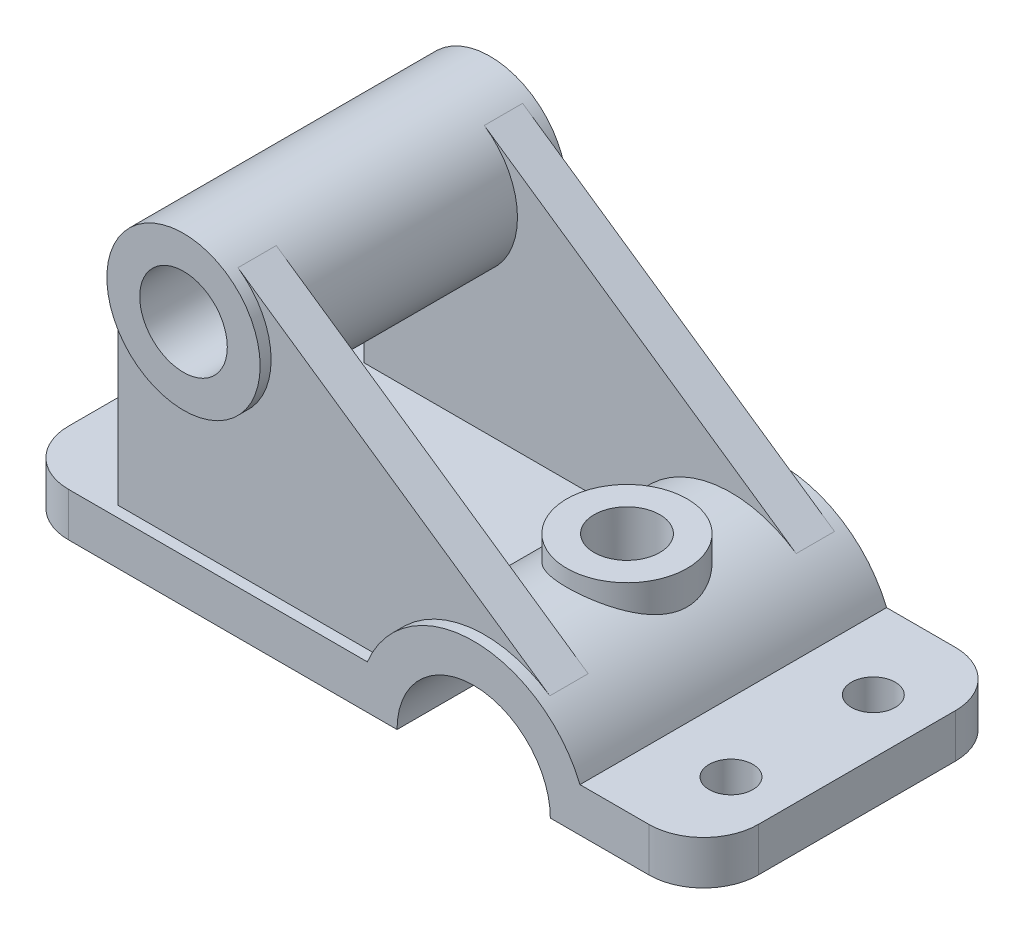
from build123d import *

# Parameters (mm, degrees)
BOSS_EXTRUDE1_DEPTH = 56
FILLET1_R           = 10
SKETCH2_R           = 4
CUT_EXTRUDE1_DEPTH  = 56
SKETCH4_R           = 11
SKETCH4_R_2         = 6
BOSS_EXTRUDE2_DEPTH = 10
CUT_EXTRUDE2_START  = -34
SKETCH5_R           = 6
CUT_EXTRUDE2_DEPTH  = 34
SKETCH6_R           = 14
SKETCH6_R_2         = 8
BOSS_EXTRUDE3_DEPTH = 56
BOSS_EXTRUDE4_START = -7
BOSS_EXTRUDE4_DEPTH = 7
BOSS_EXTRUDE5_DEPTH = 7


with BuildPart() as part:
    # Sketch1 → Boss-Extrude1 (new body)
    with BuildSketch(Plane.XY):
        with BuildLine():
            Line((0, 0), (70, 0))
            ThreePointArc((70, 0), (84, 14), (98, 0))
            Line((98, 0), (126, 0))
            Line((126, 0), (126, 8))
            Line((126, 8), (103.416487839, 8))
            ThreePointArc((103.416487839, 8), (84, 21), (64.583512161, 8))
            Line((64.583512161, 8), (0, 8))
            Line((0, 8), (0, 0))
        make_face()
    extrude(amount=BOSS_EXTRUDE1_DEPTH)

    # Fillet1
    fillet1_edges = [part.edges().sort_by_distance(p)[0] for p in [
        (0, 4, 0),
        (126, 4, 56),
        (0, 4, 56),
        (126, 4, 0),
    ]]
    fillet(fillet1_edges, radius=FILLET1_R)

    # Sketch2 → Cut-Extrude1 (cut)
    with BuildSketch(Plane(origin=(0, 8, 0), x_dir=(1, 0, 0), z_dir=(0, 1, 0))):
        with Locations(Location((10, -15, 0), (0, 0, 270))):
            Circle(SKETCH2_R)
        with Locations(Location((10, -41, 0), (0, 0, 270))):
            Circle(SKETCH2_R)
        with Locations(Location((116, -15, 0), (0, 0, 270))):
            Circle(SKETCH2_R)
        with Locations(Location((116, -41, 0), (0, 0, 270))):
            Circle(SKETCH2_R)
    extrude(amount=-CUT_EXTRUDE1_DEPTH, mode=Mode.SUBTRACT)

    # Sketch4 → Boss-Extrude2 (add)
    with BuildSketch(Plane(origin=(0, 14, 0), x_dir=(-1, 0, 0), z_dir=(0, -1, 0))):
        with Locations(Location((-84, -28, 0), (0, 0, 90))):
            Circle(SKETCH4_R)
        with Locations(Location((-84, -28, 0), (0, 0, 90))):
            Circle(SKETCH4_R_2, mode=Mode.SUBTRACT)
    extrude(amount=-BOSS_EXTRUDE2_DEPTH)

    # Sketch5 → Cut-Extrude2 (cut)
    with BuildSketch(Plane(origin=(0, 24, 0), x_dir=(1, 0, 0), z_dir=(0, 1, 0)).offset(CUT_EXTRUDE2_START)):
        with Locations(Location((84, -28, 0), (0, 0, 90))):
            Circle(SKETCH5_R)
    extrude(amount=CUT_EXTRUDE2_DEPTH, mode=Mode.SUBTRACT)



with BuildPart() as body_2:
    # Sketch6 → Boss-Extrude3 (new body)
    with BuildSketch(Plane.XY):
        with Locations((31, 45)):
            Circle(SKETCH6_R)
        with Locations((31, 45)):
            Circle(SKETCH6_R_2, mode=Mode.SUBTRACT)
    extrude(amount=BOSS_EXTRUDE3_DEPTH)


with BuildPart() as part_1:
    add(part.part)

    add(body_2.part)  # Boss-Extrude4 merges body 2
    # Sketch7 → Boss-Extrude4 (add)
    with BuildSketch(Plane.XY.offset(54).offset(BOSS_EXTRUDE4_START)):
        with BuildLine():
            Line((17, 45), (17, 8))
            Line((17, 8), (64.583512161, 8))
            ThreePointArc((64.583512161, 8), (78.026449954, 20.132478731), (95.911075968, 17.295267251))
            Line((95.911075968, 17.295267251), (38.940717312, 56.530178167))
            ThreePointArc((38.940717312, 56.530178167), (37.512678314, 32.607057606), (17, 45))
        make_face()
    extrude(amount=BOSS_EXTRUDE4_DEPTH)

    # Sketch8 → Boss-Extrude5 (add)
    with BuildSketch(Plane(origin=(0, 0, 2), x_dir=(-1, 0, 0), z_dir=(0, 0, -1))):
        with BuildLine():
            Line((-17, 45), (-17, 8))
            Line((-17, 8), (-64.583512161, 8))
            ThreePointArc((-64.583512161, 8), (-78.026449954, 20.132478731), (-95.911075968, 17.295267251))
            Line((-95.911075968, 17.295267251), (-38.940717312, 56.530178167))
            ThreePointArc((-38.940717312, 56.530178167), (-37.512678314, 32.607057606), (-17, 45))
        make_face()
    extrude(amount=-BOSS_EXTRUDE5_DEPTH)


solid = part_1.part
